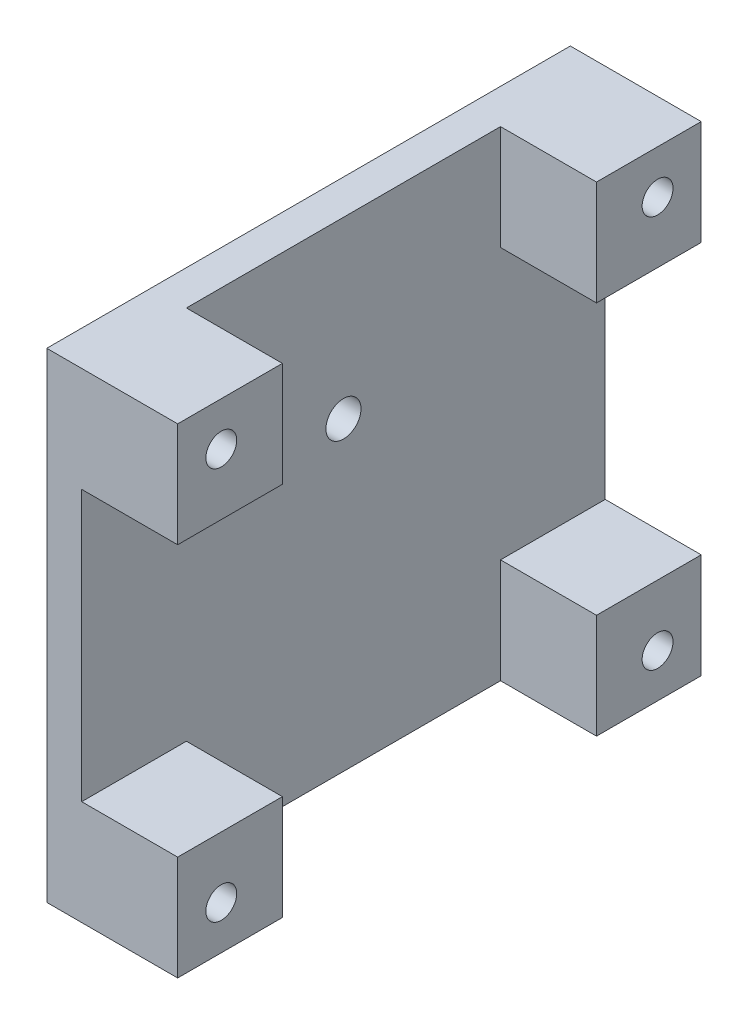
from build123d import *

# Parameters (mm, degrees)
SKETCH1_W                                      = 76.2
SKETCH1_H                                      = 69.85
BOSS_EXTRUDE1_DEPTH                            = 19.05
CUT_EXTRUDE1_DEPTH                             = 13.97
CBORE_FOR_8_SOCKET_HEAD_CAP_SCREW1_D           = 4.4958
CBORE_FOR_8_SOCKET_HEAD_CAP_SCREW1_CBORE_D     = 7.9375
CBORE_FOR_8_SOCKET_HEAD_CAP_SCREW1_CBORE_DEPTH = 4.1656
F_1_4_20_TAPPED_HOLE1_D                        = 5.1054
F_1_4_20_TAPPED_HOLE1_DEPTH                    = 19.05
F_1_4_20_TAPPED_HOLE1_TIP                      = 1.533816902


with BuildPart() as part:
    # Sketch1 → Boss-Extrude1 (new body)
    with BuildSketch(Plane(origin=(0, 0, 0), x_dir=(0, 0, -1), z_dir=(1, 0, 0))):
        Rectangle(SKETCH1_W, SKETCH1_H)
    extrude(amount=BOSS_EXTRUDE1_DEPTH)

    # Sketch2 → Cut-Extrude1 (cut)
    with BuildSketch(Plane(origin=(19.05, 0, 0), x_dir=(0, 0, -1), z_dir=(1, 0, 0))):
        Polygon((-22.86, -34.925), (22.86, -34.925), (22.86, -19.685), (38.1, -19.685), (38.1, 19.685), (22.86, 19.685), (22.86, 34.925), (-22.86, 34.925), (-22.86, 19.685), (-38.1, 19.685), (-38.1, -19.685), (-22.86, -19.685), align=None)
    extrude(amount=-CUT_EXTRUDE1_DEPTH, mode=Mode.SUBTRACT)

    # CBORE for #8 Socket Head Cap Screw1 (through all)
    with Locations(Plane(origin=(0, -5.74842533, -9.122205943), x_dir=(0, 0, -1), z_dir=(-1, 0, 0))):
        with Locations((-40.872205943, -34.32342533), (22.627794057, -34.32342533), (22.627794057, 22.82657467), (-40.872205943, 22.82657467)):
            CounterBoreHole(CBORE_FOR_8_SOCKET_HEAD_CAP_SCREW1_D / 2, CBORE_FOR_8_SOCKET_HEAD_CAP_SCREW1_CBORE_D / 2, CBORE_FOR_8_SOCKET_HEAD_CAP_SCREW1_CBORE_DEPTH)

    # 1/4-20 Tapped Hole1
    with Locations(Plane(origin=(5.08, 0, 0), x_dir=(0, 0, -1), z_dir=(1, 0, 0))):
        with Locations((0, 9.525)):
            Hole(F_1_4_20_TAPPED_HOLE1_D / 2, depth=F_1_4_20_TAPPED_HOLE1_DEPTH)
            with Locations((0, 0, -(F_1_4_20_TAPPED_HOLE1_DEPTH + F_1_4_20_TAPPED_HOLE1_TIP / 2))):  # 118° drill point
                Cone(0, F_1_4_20_TAPPED_HOLE1_D / 2, F_1_4_20_TAPPED_HOLE1_TIP, mode=Mode.SUBTRACT)


solid = part.part
